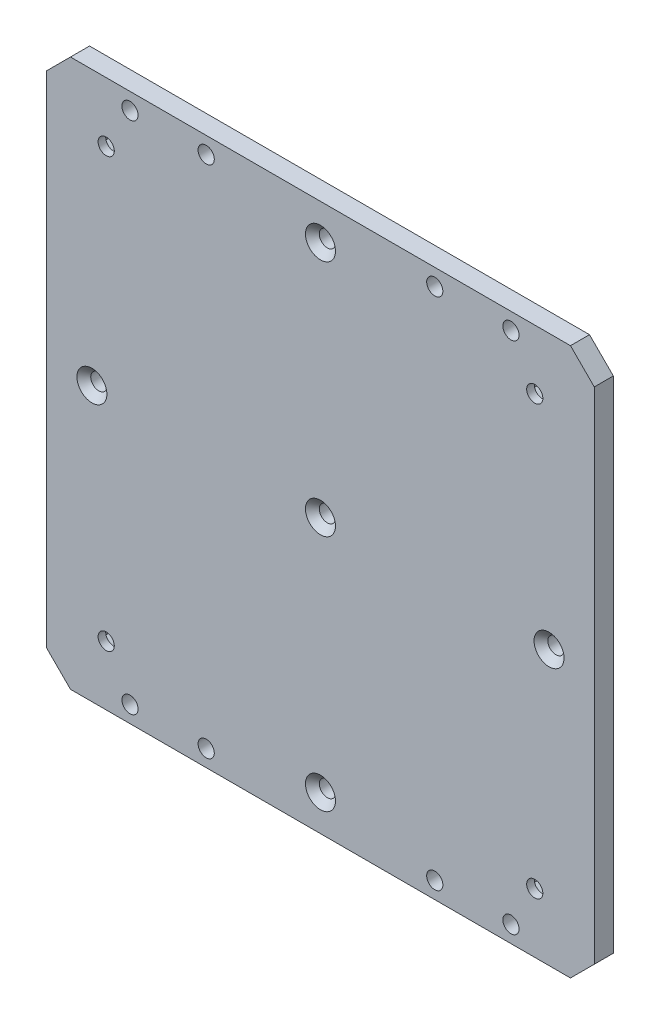
from build123d import *

# Parameters (mm, degrees)
SKETCH2_W                                       = 57.5
SKETCH2_H                                       = 57.5
BOSS_EXTRUDE1_DEPTH                             = 4
CUT_EXTRUDE4_DEPTH                              = 2.4
M3_CLEARANCE_HOLE1_D                            = 3.4
CSK_FOR_M3_FLAT_HEAD_MACHINE_SCREW1_D           = 3.4
CSK_FOR_M3_FLAT_HEAD_MACHINE_SCREW1_CSINK_D     = 6.3
CSK_FOR_M3_FLAT_HEAD_MACHINE_SCREW1_CSINK_ANGLE = 90
CSK_FOR_M3_FLAT_HEAD_MACHINE_SCREW2_D           = 3.4
CSK_FOR_M3_FLAT_HEAD_MACHINE_SCREW2_CSINK_D     = 6.3
CSK_FOR_M3_FLAT_HEAD_MACHINE_SCREW2_CSINK_ANGLE = 90
CHAMFER1_SIZE                                   = 5


with BuildPart() as part:
    # Sketch2 → Boss-Extrude1 (new body)
    with BuildSketch(Plane.XY):
        with Locations((28.75, 28.75)):
            Rectangle(SKETCH2_W, SKETCH2_H)
    extrude(amount=BOSS_EXTRUDE1_DEPTH)

    # Sketch12 → Cut-Extrude4 (cut)
    with BuildSketch(Plane.XY):
        Polygon((45, 41.766838493), (47.8, 43.383419246), (47.8, 46.616580754), (45, 48.233161507), (42.2, 46.616580754), (42.2, 43.383419246), align=None)
    extrude(amount=CUT_EXTRUDE4_DEPTH, mode=Mode.SUBTRACT)

    # M3 Clearance Hole1 (through all)
    with Locations(Plane.XY.offset(4)):
        with Locations((45, 45), (-45, 45), (-45, -45), (45, -45)):
            Hole(M3_CLEARANCE_HOLE1_D / 2)

    # CSK for M3 Flat Head Machine Screw1 (through all)
    with Locations(Plane.XY.offset(4)):
        with Locations((0, 50), (0, 0), (48, 0)):
            CounterSinkHole(CSK_FOR_M3_FLAT_HEAD_MACHINE_SCREW1_D / 2, CSK_FOR_M3_FLAT_HEAD_MACHINE_SCREW1_CSINK_D / 2, counter_sink_angle=CSK_FOR_M3_FLAT_HEAD_MACHINE_SCREW1_CSINK_ANGLE)

    # CSK for M3 Flat Head Machine Screw2 (through all)
    with Locations(Plane(origin=(0, 0, 0), x_dir=(-1, 0, 0), z_dir=(0, 0, -1))):
        with Locations((-24, 54), (-40, 54)):
            CounterSinkHole(CSK_FOR_M3_FLAT_HEAD_MACHINE_SCREW2_D / 2, CSK_FOR_M3_FLAT_HEAD_MACHINE_SCREW2_CSINK_D / 2, counter_sink_angle=CSK_FOR_M3_FLAT_HEAD_MACHINE_SCREW2_CSINK_ANGLE)

    # Chamfer1
    chamfer1_edges = [part.edges().sort_by_distance(p)[0] for p in [
        (57.5, 57.5, 2),
    ]]
    chamfer(chamfer1_edges, length=CHAMFER1_SIZE)

    # Mirror1: part across plane


with BuildPart() as part_1:
    add(part.part)
    add(part.part.mirror(Plane(origin=(0, 0, 0), x_dir=(0, 0, 1), z_dir=(0, -1, 0))))

    # Mirror2: part across plane


with BuildPart() as part_2:
    add(part_1.part)
    add(part_1.part.mirror(Plane(origin=(0, 0, 0), x_dir=(0, 0, 1), z_dir=(1, 0, 0))))


solid = part_2.part
